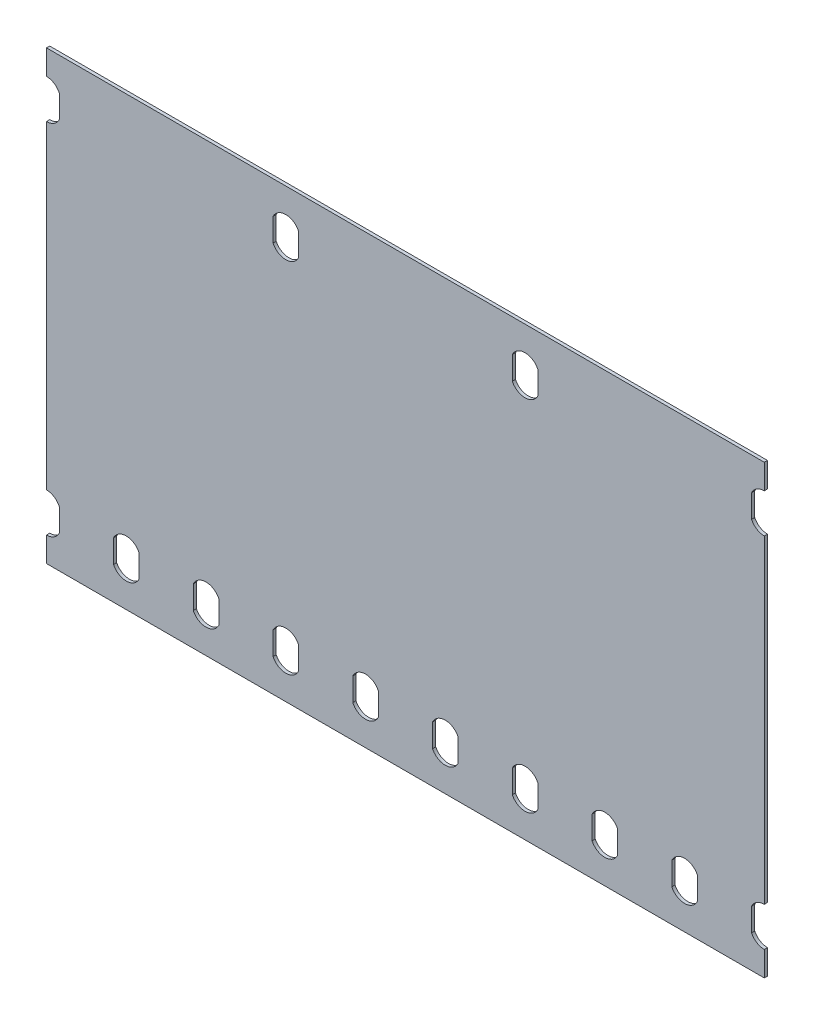
from build123d import *

# Parameters (mm, degrees)
BOSS_EXTRUDE1_DEPTH = 0.2


with BuildPart() as part:
    # Sketch1 → Boss-Extrude1 (new body)
    with BuildSketch(Plane.XY):
        with BuildLine():
            Line((45, 4), (45, 24))
            ThreePointArc((45, 24), (44.528300943, 24.135281509), (44.2, 24.5))
            Line((44.2, 24.5), (44.2, 25.95))
            ThreePointArc((44.2, 25.95), (44.528298555, 26.31472475), (45, 26.450009012))
            Line((45, 26.450009012), (45, 28))
            Line((45, 28), (0, 28))
            Line((0, 28), (0, 26.450009012))
            ThreePointArc((0, 26.450009012), (0.471701445, 26.31472475), (0.8, 25.95))
            Line((0.8, 25.95), (0.8, 24.5))
            ThreePointArc((0.8, 24.5), (0.471699057, 24.135281509), (0, 24))
            Line((0, 24), (0, 4))
            ThreePointArc((0, 4), (0.471699057, 3.864718491), (0.8, 3.5))
            Line((0.8, 3.5), (0.8, 2.05))
            ThreePointArc((0.8, 2.05), (0.471701445, 1.68527525), (0, 1.549990988))
            Line((0, 1.549990988), (0, 0))
            Line((0, 0), (45, 0))
            Line((45, 0), (45, 1.549990988))
            ThreePointArc((45, 1.549990988), (44.528298555, 1.68527525), (44.2, 2.05))
            Line((44.2, 2.05), (44.2, 3.5))
            ThreePointArc((44.2, 3.5), (44.528300943, 3.864718491), (45, 4))
        make_face()
        with BuildLine():
            ThreePointArc((30.8, 24.5), (30, 24), (29.2, 24.5))
            Line((29.2, 24.5), (29.2, 25.95))
            ThreePointArc((29.2, 25.95), (30, 26.450009012), (30.8, 25.95))
            Line((30.8, 25.95), (30.8, 24.5))
        make_face(mode=Mode.SUBTRACT)
        with BuildLine():
            Line((14.2, 24.5), (14.2, 25.95))
            ThreePointArc((14.2, 25.95), (15, 26.450009012), (15.8, 25.95))
            Line((15.8, 25.95), (15.8, 24.5))
            ThreePointArc((15.8, 24.5), (15, 24), (14.2, 24.5))
        make_face(mode=Mode.SUBTRACT)
        with BuildLine():
            Line((34.2, 2.05), (34.2, 3.5))
            ThreePointArc((34.2, 3.5), (35, 4), (35.8, 3.5))
            Line((35.8, 3.5), (35.8, 2.05))
            ThreePointArc((35.8, 2.05), (35, 1.549990988), (34.2, 2.05))
        make_face(mode=Mode.SUBTRACT)
        with BuildLine():
            Line((30.8, 3.5), (30.8, 2.05))
            ThreePointArc((30.8, 2.05), (30, 1.549990988), (29.2, 2.05))
            Line((29.2, 2.05), (29.2, 3.5))
            ThreePointArc((29.2, 3.5), (30, 4), (30.8, 3.5))
        make_face(mode=Mode.SUBTRACT)
        with BuildLine():
            ThreePointArc((4.2, 3.5), (5, 4), (5.8, 3.5))
            Line((5.8, 3.5), (5.8, 2.05))
            ThreePointArc((5.8, 2.05), (5, 1.549990988), (4.2, 2.05))
            Line((4.2, 2.05), (4.2, 3.5))
        make_face(mode=Mode.SUBTRACT)
        with BuildLine():
            ThreePointArc((9.2, 3.5), (10, 4), (10.8, 3.5))
            Line((10.8, 3.5), (10.8, 2.05))
            ThreePointArc((10.8, 2.05), (10, 1.549990988), (9.2, 2.05))
            Line((9.2, 2.05), (9.2, 3.5))
        make_face(mode=Mode.SUBTRACT)
        with BuildLine():
            ThreePointArc((14.2, 3.5), (15, 4), (15.8, 3.5))
            Line((15.8, 3.5), (15.8, 2.05))
            ThreePointArc((15.8, 2.05), (15, 1.549990988), (14.2, 2.05))
            Line((14.2, 2.05), (14.2, 3.5))
        make_face(mode=Mode.SUBTRACT)
        with BuildLine():
            ThreePointArc((19.2, 3.5), (20, 4), (20.8, 3.5))
            Line((20.8, 3.5), (20.8, 2.05))
            ThreePointArc((20.8, 2.05), (20, 1.549990988), (19.2, 2.05))
            Line((19.2, 2.05), (19.2, 3.5))
        make_face(mode=Mode.SUBTRACT)
        with BuildLine():
            ThreePointArc((24.2, 3.5), (25, 4), (25.8, 3.5))
            Line((25.8, 3.5), (25.8, 2.05))
            ThreePointArc((25.8, 2.05), (25, 1.549990988), (24.2, 2.05))
            Line((24.2, 2.05), (24.2, 3.5))
        make_face(mode=Mode.SUBTRACT)
        with BuildLine():
            ThreePointArc((39.2, 3.5), (40, 4), (40.8, 3.5))
            Line((40.8, 3.5), (40.8, 2.05))
            ThreePointArc((40.8, 2.05), (40, 1.549990988), (39.2, 2.05))
            Line((39.2, 2.05), (39.2, 3.5))
        make_face(mode=Mode.SUBTRACT)
    extrude(amount=BOSS_EXTRUDE1_DEPTH)


solid = part.part
